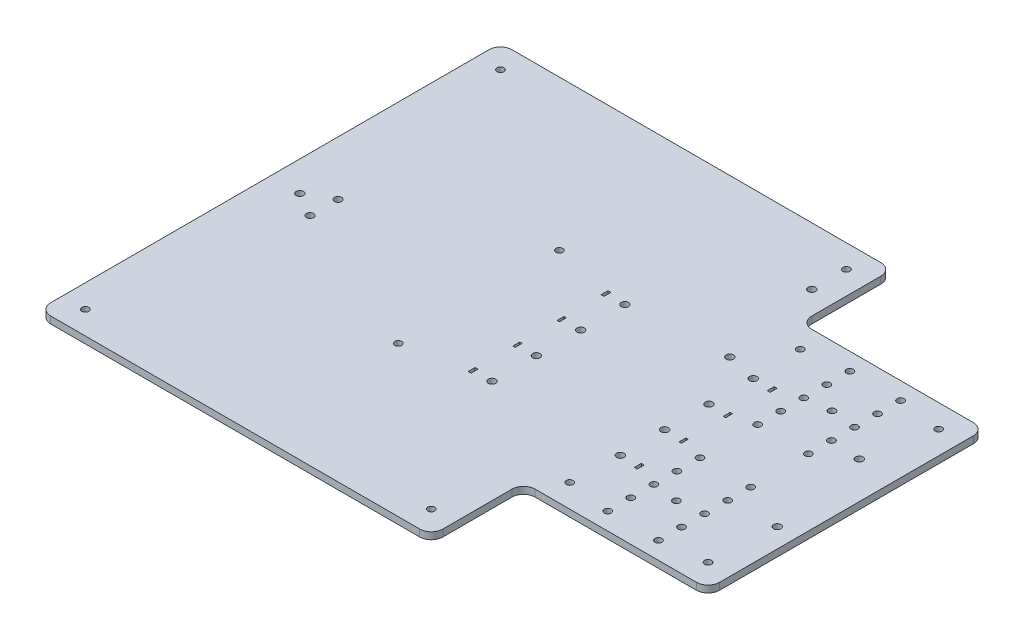
from build123d import *

# Parameters (mm, degrees)
SKETCH1_R           = 1.575
SKETCH1_R_2         = 1.5
BOSS_EXTRUDE1_DEPTH = 3
FILLET1_R           = 5
SKETCH2_R           = 1.6
SKETCH2_R_2         = 1.5
SKETCH2_W           = 1
SKETCH2_H           = 3
SKETCH2_W_2         = 1.255583802
CUT_EXTRUDE1_DEPTH  = 3


with BuildPart() as part:
    # Sketch1 → Boss-Extrude1 (new body)
    with BuildSketch(Plane(origin=(0, 0, 0), x_dir=(1, 0, 0), z_dir=(0, 1, 0))):
        Polygon((30.311923219, 82.53968254), (-139.688076781, 82.53968254), (-139.688076781, -117.46031746), (30.311923219, -117.46031746), (30.311923219, -77.46031746), (110.311923219, -77.46031746), (110.311923219, 42.53968254), (30.311923219, 42.53968254), align=None)
        with Locations(Location((-126.688076781, -17.46031746, 0), (0, 0, 270))):
            Circle(SKETCH1_R, mode=Mode.SUBTRACT)
        with Locations(Location((-116.188076781, -11.398139634, 0), (0, 0, 270))):
            Circle(SKETCH1_R, mode=Mode.SUBTRACT)
        with Locations(Location((-116.188076781, -23.522495287, 0), (0, 0, 270))):
            Circle(SKETCH1_R, mode=Mode.SUBTRACT)
        with Locations(Location((-129.688076781, 72.53968254, 0), (0, 0, 270))):
            Circle(SKETCH1_R_2, mode=Mode.SUBTRACT)
        with Locations(Location((20.311923219, 72.53968254, 0), (0, 0, 270))):
            Circle(SKETCH1_R_2, mode=Mode.SUBTRACT)
        with Locations(Location((81.311923219, 35.03968254, 0), (0, 0, 270))):
            Circle(SKETCH1_R_2, mode=Mode.SUBTRACT)
        with Locations(Location((81.311923219, 25.03968254, 0), (0, 0, 270))):
            Circle(SKETCH1_R_2, mode=Mode.SUBTRACT)
        with Locations(Location((81.311923219, 15.03968254, 0), (0, 0, 270))):
            Circle(SKETCH1_R_2, mode=Mode.SUBTRACT)
        with Locations(Location((81.311923219, 5.03968254, 0), (0, 0, 270))):
            Circle(SKETCH1_R_2, mode=Mode.SUBTRACT)
        with Locations(Location((81.311923219, -4.96031746, 0), (0, 0, 270))):
            Circle(SKETCH1_R_2, mode=Mode.SUBTRACT)
        with Locations(Location((59.311923219, -4.96031746, 0), (0, 0, 90))):
            Circle(SKETCH1_R_2, mode=Mode.SUBTRACT)
        with Locations(Location((59.311923219, 5.03968254, 0), (0, 0, 90))):
            Circle(SKETCH1_R_2, mode=Mode.SUBTRACT)
        with Locations(Location((59.311923219, 15.03968254, 0), (0, 0, 90))):
            Circle(SKETCH1_R_2, mode=Mode.SUBTRACT)
        with Locations(Location((59.311923219, 25.03968254, 0), (0, 0, 90))):
            Circle(SKETCH1_R_2, mode=Mode.SUBTRACT)
        with Locations(Location((59.311923219, 35.03968254, 0), (0, 0, 90))):
            Circle(SKETCH1_R_2, mode=Mode.SUBTRACT)
        with Locations(Location((81.311923219, -69.96031746, 0), (0, 0, 90))):
            Circle(SKETCH1_R_2, mode=Mode.SUBTRACT)
        with Locations(Location((81.311923219, -59.96031746, 0), (0, 0, 90))):
            Circle(SKETCH1_R_2, mode=Mode.SUBTRACT)
        with Locations(Location((81.311923219, -49.96031746, 0), (0, 0, 90))):
            Circle(SKETCH1_R_2, mode=Mode.SUBTRACT)
        with Locations(Location((81.311923219, -39.96031746, 0), (0, 0, 90))):
            Circle(SKETCH1_R_2, mode=Mode.SUBTRACT)
        with Locations(Location((81.311923219, -29.96031746, 0), (0, 0, 90))):
            Circle(SKETCH1_R_2, mode=Mode.SUBTRACT)
        with Locations(Location((59.311923219, -29.96031746, 0), (0, 0, 270))):
            Circle(SKETCH1_R_2, mode=Mode.SUBTRACT)
        with Locations(Location((59.311923219, -39.96031746, 0), (0, 0, 270))):
            Circle(SKETCH1_R_2, mode=Mode.SUBTRACT)
        with Locations(Location((59.311923219, -49.96031746, 0), (0, 0, 270))):
            Circle(SKETCH1_R_2, mode=Mode.SUBTRACT)
        with Locations(Location((59.311923219, -59.96031746, 0), (0, 0, 270))):
            Circle(SKETCH1_R_2, mode=Mode.SUBTRACT)
        with Locations(Location((59.311923219, -69.96031746, 0), (0, 0, 270))):
            Circle(SKETCH1_R_2, mode=Mode.SUBTRACT)
        with Locations(Location((100.311923219, 32.53968254, 0), (0, 0, 270))):
            Circle(SKETCH1_R_2, mode=Mode.SUBTRACT)
        with Locations(Location((40.311923219, 32.53968254, 0), (0, 0, 90))):
            Circle(SKETCH1_R_2, mode=Mode.SUBTRACT)
        with Locations(Location((100.311923219, -67.46031746, 0), (0, 0, 90))):
            Circle(SKETCH1_R_2, mode=Mode.SUBTRACT)
        with Locations(Location((40.311923219, -67.46031746, 0), (0, 0, 270))):
            Circle(SKETCH1_R_2, mode=Mode.SUBTRACT)
        with Locations(Location((20.311923219, -107.46031746, 0), (0, 0, 90))):
            Circle(SKETCH1_R_2, mode=Mode.SUBTRACT)
        with Locations(Location((-129.688076781, -107.46031746, 0), (0, 0, 90))):
            Circle(SKETCH1_R_2, mode=Mode.SUBTRACT)
    extrude(amount=BOSS_EXTRUDE1_DEPTH)

    # Fillet1
    fillet1_edges = [part.edges().sort_by_distance(p)[0] for p in [
        (-139.688076781, 1.5, -82.53968254),
        (30.311923219, 1.5, -82.53968254),
        (30.311923219, 1.5, -42.53968254),
        (110.311923219, 1.5, -42.53968254),
        (110.311923219, 1.5, 77.46031746),
        (30.311923219, 1.5, 77.46031746),
        (30.311923219, 1.5, 117.46031746),
        (-139.688076781, 1.5, 117.46031746),
    ]]
    fillet(fillet1_edges, radius=FILLET1_R)

    # Sketch2 → Cut-Extrude1 (cut)
    with BuildSketch(Plane(origin=(0, 3, 0), x_dir=(1, 0, 0), z_dir=(0, 1, 0))):
        with Locations(Location((101.931923219, -39.05031746, 0), (0, 0, 270))):
            Circle(SKETCH2_R)
        with Locations(Location((94.311923219, 4.12968254, 0), (0, 0, 270))):
            Circle(SKETCH2_R)
        with Locations(Location((41.101923219, -7.85531746, 0), (0, 0, 270))):
            Circle(SKETCH2_R)
        with Locations(Location((41.101923219, 11.35468254, 0), (0, 0, 270))):
            Circle(SKETCH2_R)
        with Locations(Location((41.101923219, -46.27531746, 0), (0, 0, 270))):
            Circle(SKETCH2_R)
        with Locations(Location((41.101923219, -27.06531746, 0), (0, 0, 270))):
            Circle(SKETCH2_R)
        with Locations(Location((-14.518076781, -7.85531746, 0), (0, 0, 270))):
            Circle(SKETCH2_R)
        with Locations(Location((-14.518076781, 11.35468254, 0), (0, 0, 270))):
            Circle(SKETCH2_R)
        with Locations(Location((-14.518076781, -27.06531746, 0), (0, 0, 270))):
            Circle(SKETCH2_R)
        with Locations(Location((-14.518076781, -46.27531746, 0), (0, 0, 270))):
            Circle(SKETCH2_R)
        with Locations(Location((-49.062510974, -52.38531746, 0), (0, 0, 270))):
            Circle(SKETCH2_R_2)
        with Locations(Location((-49.062510974, 17.46468254, 0), (0, 0, 270))):
            Circle(SKETCH2_R_2)
        with Locations(Location((70.311923219, -51.21031746, 0), (0, 0, 270))):
            Circle(SKETCH2_R_2)
        with Locations(Location((70.311923219, 16.28968254, 0), (0, 0, 270))):
            Circle(SKETCH2_R_2)
        with Locations(Location((27.931923219, 14.35968254, 0), (0, 0, 270))):
            Circle(SKETCH2_R)
        with Locations(Location((20.311923219, 57.53968254, 0), (0, 0, 270))):
            Circle(SKETCH2_R)
        with Locations((49.311923219, -7.85531746)):
            Rectangle(SKETCH2_W, SKETCH2_H)
        with Locations((49.311923219, -27.06531746)):
            Rectangle(SKETCH2_W, SKETCH2_H)
        with Locations((49.311923219, -46.27531746)):
            Rectangle(SKETCH2_W_2, SKETCH2_H)
        with Locations((49.311923219, 11.35468254)):
            Rectangle(SKETCH2_W_2, SKETCH2_H)
        with Locations((-22.728076781, 11.35468254)):
            Rectangle(SKETCH2_W_2, SKETCH2_H)
        with Locations((-22.728076781, -7.85531746)):
            Rectangle(SKETCH2_W, SKETCH2_H)
        with Locations((-22.728076781, -27.06531746)):
            Rectangle(SKETCH2_W, SKETCH2_H)
        with Locations((-22.728076781, -46.27531746)):
            Rectangle(SKETCH2_W_2, SKETCH2_H)
    extrude(amount=-CUT_EXTRUDE1_DEPTH, mode=Mode.SUBTRACT)


solid = part.part
